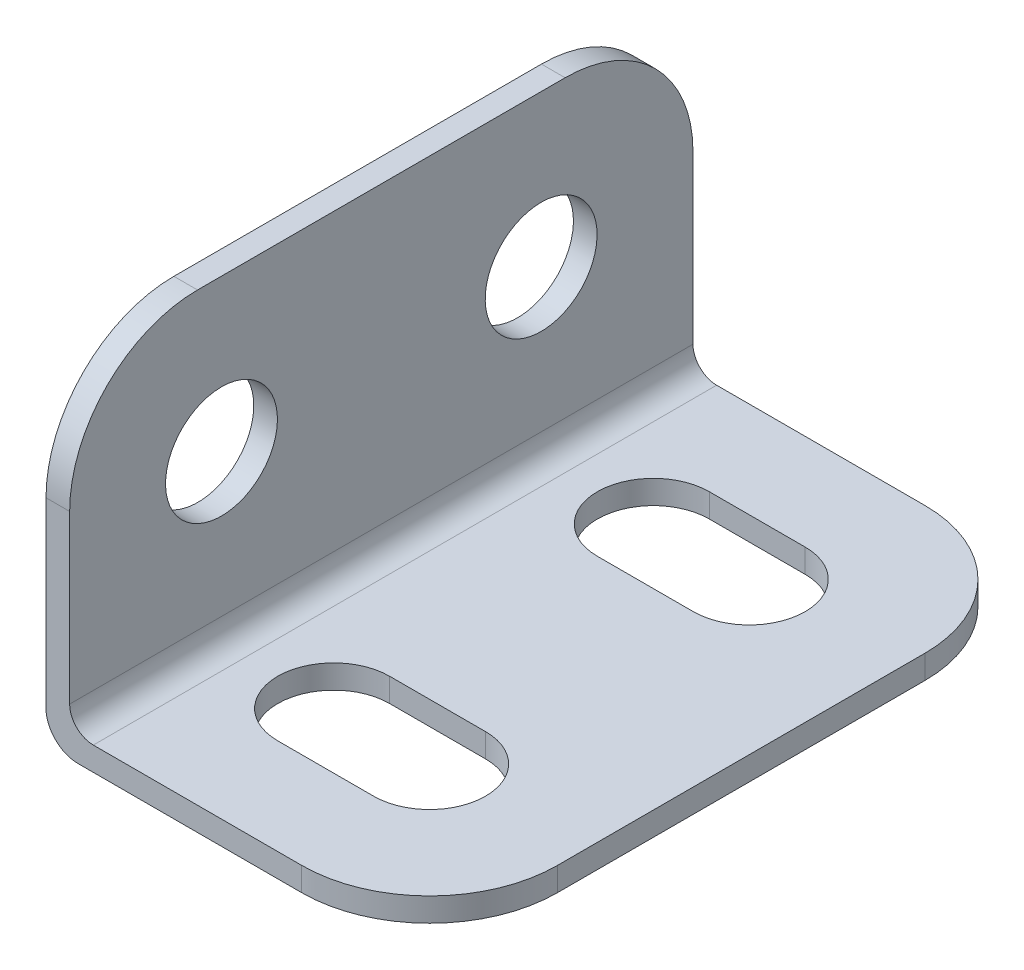
from build123d import *

# Parameters (mm, degrees)
ANGLE_BRACKET_DEPTH = 24.765
CORNERS_R           = 5.08
SKETCH2_R           = 2.2225
HOLES_DEPTH         = 32.661678194
SLOTS_DEPTH         = 32.710646251


with BuildPart() as part:
    # Sketch1 → Angle Bracket (new body)
    with BuildSketch(Plane.XY):
        with BuildLine():
            Line((0, 13.589), (0, 1.27))
            ThreePointArc((0, 1.27), (0.371974388, 0.371974388), (1.27, 0))
            Line((1.27, 0), (15.24, 0))
            Line((15.24, 0), (15.24, 0.9398))
            Line((15.24, 0.9398), (1.8796, 0.9398))
            ThreePointArc((1.8796, 0.9398), (1.215061047, 1.215061047), (0.9398, 1.8796))
            Line((0.9398, 1.8796), (0.9398, 13.589))
            Line((0.9398, 13.589), (0, 13.589))
        make_face()
    extrude(amount=-ANGLE_BRACKET_DEPTH)

    # Corners
    corners_edges = [part.edges().sort_by_distance(p)[0] for p in [
        (0.4699, 13.589, 0),
        (15.24, 0.4699, -24.765),
        (0.4699, 13.589, -24.765),
        (15.24, 0.4699, 0),
    ]]
    fillet(corners_edges, radius=CORNERS_R)

    # Sketch2 → Holes (cut, through all)
    with BuildSketch(Plane(origin=(0.9398, 0, 0), x_dir=(0, 0, -1), z_dir=(1, 0, 0))):
        with Locations(Location((6.0325, 7.5565, 0), (0, 0, 90))):
            Circle(SKETCH2_R)
        with Locations(Location((18.7325, 7.5565, 0), (0, 0, 90))):
            Circle(SKETCH2_R)
    extrude(amount=-HOLES_DEPTH, mode=Mode.SUBTRACT)

    # Sketch3 → Slots (cut, through all)
    with BuildSketch(Plane(origin=(0, 0.9398, 0), x_dir=(-1, 0, 0), z_dir=(0, 1, 0))):
        with BuildLine():
            Line((-5.3975, -3.81), (-9.2075, -3.81))
            ThreePointArc((-9.2075, -3.81), (-11.43, -6.0325), (-9.2075, -8.255))
            Line((-9.2075, -8.255), (-5.3975, -8.255))
            ThreePointArc((-5.3975, -8.255), (-3.175, -6.0325), (-5.3975, -3.81))
        make_face()
        with BuildLine():
            Line((-5.3975, -16.51), (-9.2075, -16.51))
            ThreePointArc((-9.2075, -16.51), (-11.43, -18.7325), (-9.2075, -20.955))
            Line((-9.2075, -20.955), (-5.3975, -20.955))
            ThreePointArc((-5.3975, -20.955), (-3.175, -18.7325), (-5.3975, -16.51))
        make_face()
    extrude(amount=-SLOTS_DEPTH, mode=Mode.SUBTRACT)


solid = part.part
